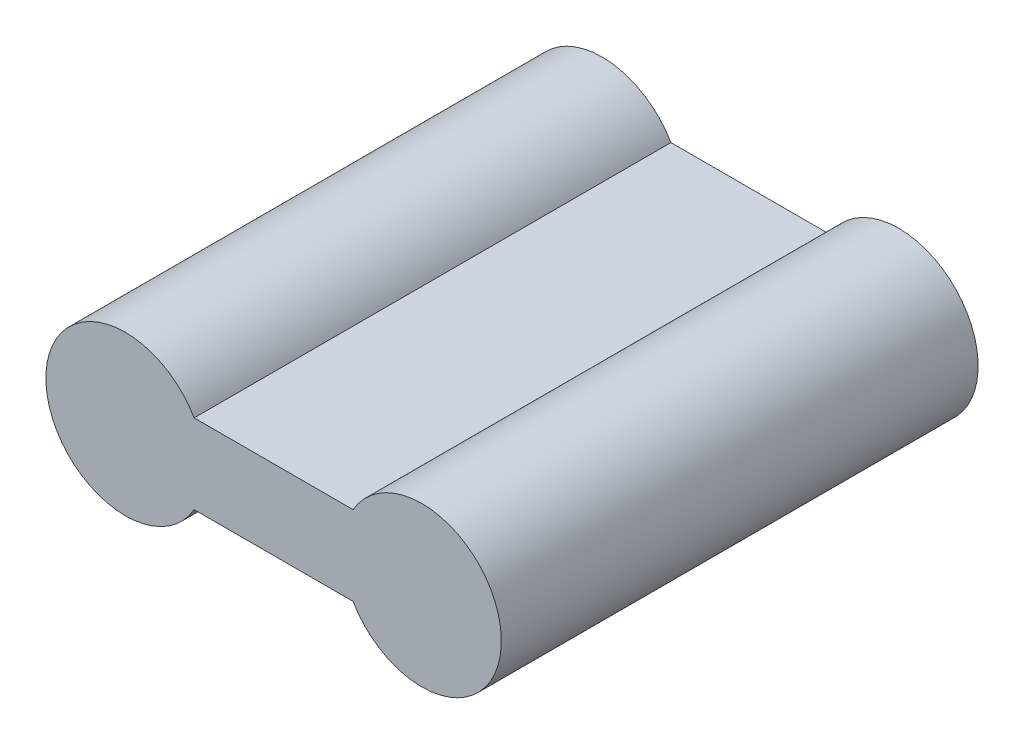
from build123d import *

# Parameters (mm, degrees)
BOSS_EXTRU_1_DEPTH = 12


with BuildPart() as part:
    # Esquisse1 → Boss.-Extru.1 (new body)
    with BuildSketch(Plane.XY):
        with BuildLine():
            Line((-2, 0), (2, 0))
            ThreePointArc((2, 0), (5.732050808, 1), (2, 2))
            Line((2, 2), (-2, 2))
            ThreePointArc((-2, 2), (-5.732050808, 1), (-2, 0))
        make_face()
    extrude(amount=BOSS_EXTRU_1_DEPTH)


solid = part.part
